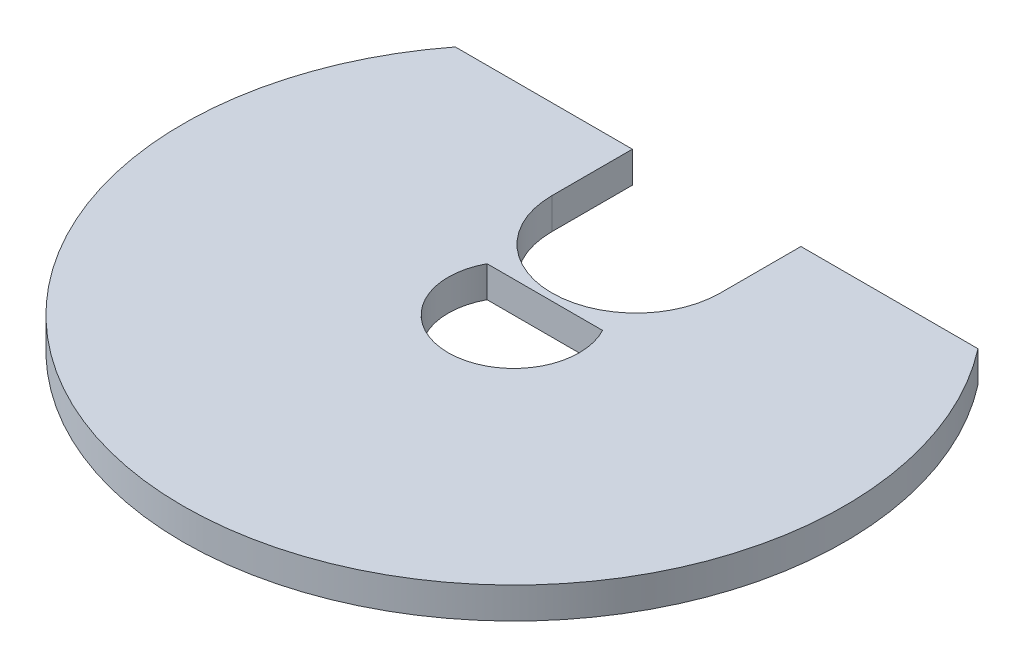
from build123d import *

# Parameters (mm, degrees)
BOSS_EXTRUDE1_DEPTH = 6.35
CUT_EXTRUDE1_DEPTH  = 96.402278275


with BuildPart() as part:
    # Sketch2 → Boss-Extrude1 (new body)
    with BuildSketch(Plane(origin=(0, 0, 0), x_dir=(1, 0, 0), z_dir=(0, 1, 0))):
        with BuildLine():
            Line((-53.169638658, 41.275), (-17.145, 41.275))
            Line((-17.145, 41.275), (-17.145, 24.892))
            ThreePointArc((-17.145, 24.892), (0, 7.747), (17.145, 24.892))
            Line((17.145, 24.892), (17.145, 41.275))
            Line((17.145, 41.275), (53.169638658, 41.275))
            ThreePointArc((53.169638658, 41.275), (0, -67.31), (-53.169638658, 41.275))
        make_face()
    extrude(amount=BOSS_EXTRUDE1_DEPTH)

    # Sketch3 → Cut-Extrude1 (cut, through all)
    with BuildSketch(Plane(origin=(0, 6.35, 0), x_dir=(1, 0, 0), z_dir=(0, 1, 0))):
        with BuildLine():
            Line((-11.7475, 6.310187695), (11.7475, 6.310187695))
            ThreePointArc((11.7475, 6.310187695), (0, -13.335), (-11.7475, 6.310187695))
        make_face()
    extrude(amount=-CUT_EXTRUDE1_DEPTH, mode=Mode.SUBTRACT)


solid = part.part
